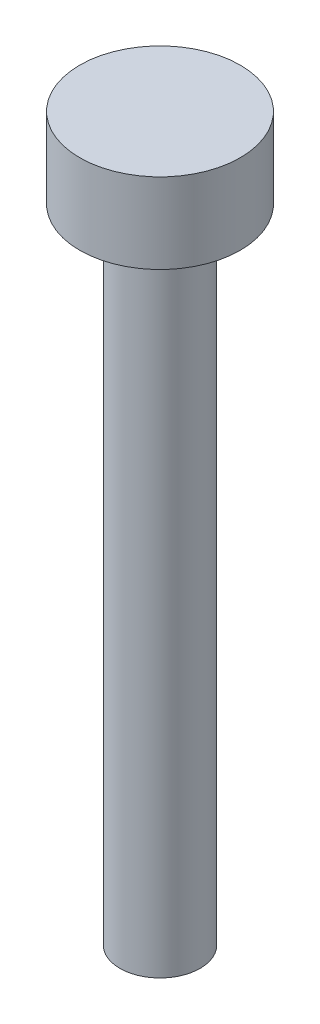
from build123d import *

# Parameters (mm, degrees)
SKETCH1_R           = 3.175
BOSS_EXTRUDE1_DEPTH = 50.8
SKETCH2_R           = 6.35
BOSS_EXTRUDE2_DEPTH = 6.35


with BuildPart() as part:
    # Sketch1 → Boss-Extrude1 (new body)
    with BuildSketch(Plane(origin=(0, 0, 0), x_dir=(1, 0, 0), z_dir=(0, 1, 0))):
        with Locations(Location((0, 0, 0), (0, 0, 270))):
            Circle(SKETCH1_R)
    extrude(amount=BOSS_EXTRUDE1_DEPTH)

    # Sketch2 → Boss-Extrude2 (add)
    with BuildSketch(Plane(origin=(0, 50.8, 0), x_dir=(1, 0, 0), z_dir=(0, 1, 0))):
        with Locations(Location((0, 0, 0), (0, 0, 270))):
            Circle(SKETCH2_R)
    extrude(amount=BOSS_EXTRUDE2_DEPTH)


solid = part.part
